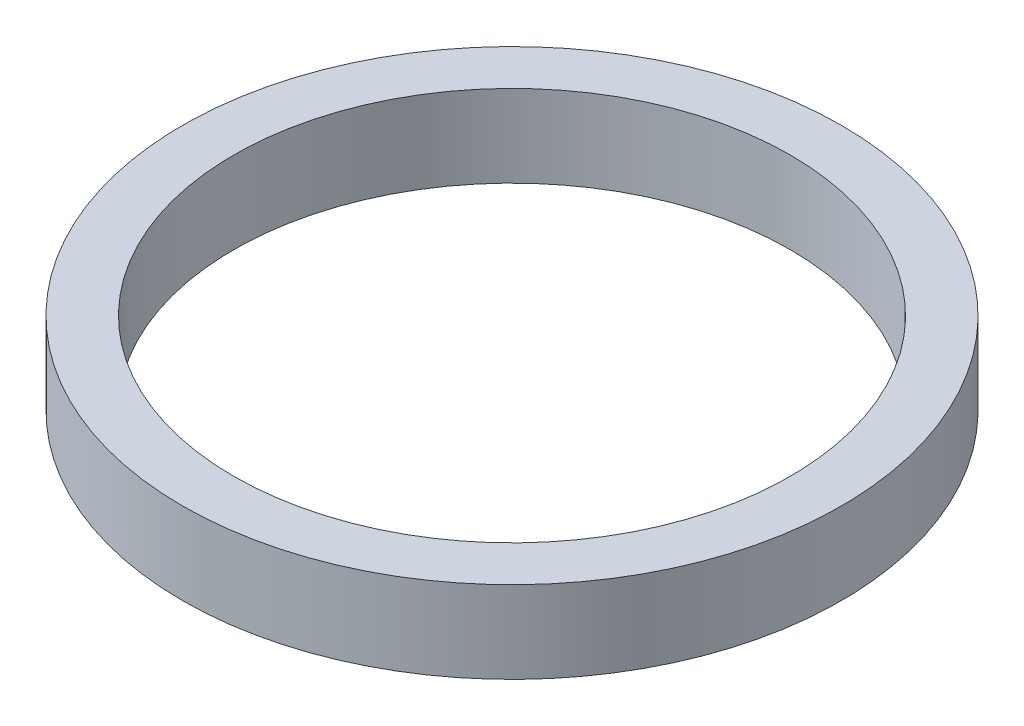
from build123d import *

# Parameters (mm, degrees)
CROQUIS1_W = 3.5
CROQUIS1_H = 5.6


with BuildPart() as part:
    # Croquis1 → Revolución1 (revolve)
    with BuildSketch(Plane.XY, mode=Mode.PRIVATE) as revoluci_n1_sk:
        with Locations((-20.75, 2.8)):
            Rectangle(CROQUIS1_W, CROQUIS1_H)
    revolve(revoluci_n1_sk.sketch.rotate(Axis((0, -6.674418605, 0), (0, 1, 0)), 270), axis=Axis((0, -6.674418605, 0), (0, 1, 0)))


solid = part.part
